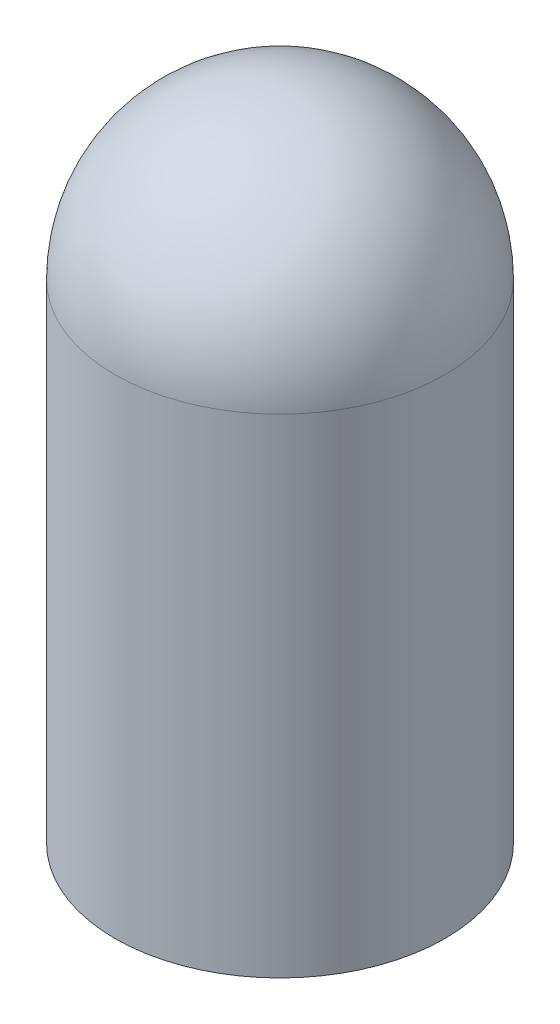
from build123d import *

# Parameters (mm, degrees)
SKETCH1_R           = 2.35
BOSS_EXTRUDE1_DEPTH = 6.95


with BuildPart() as part:
    # Sketch1 → Boss-Extrude1 (new body)
    with BuildSketch(Plane(origin=(0, 0, 0), x_dir=(1, 0, 0), z_dir=(0, 1, 0))):
        with Locations(Location((0, 0, 0), (0, 0, 270))):
            Circle(SKETCH1_R)
    extrude(amount=BOSS_EXTRUDE1_DEPTH)

    # Sketch2 → Revolve1 (revolve)
    with BuildSketch(Plane.XY):
        with BuildLine():
            Line((0, 6.95), (0, 9.3))
            ThreePointArc((0, 9.3), (1.661700936, 8.611700936), (2.35, 6.95))
            Line((2.35, 6.95), (0, 6.95))
        make_face()
    revolve(axis=Axis((0, 6.95, 0), (0, 1, 0)))


solid = part.part
